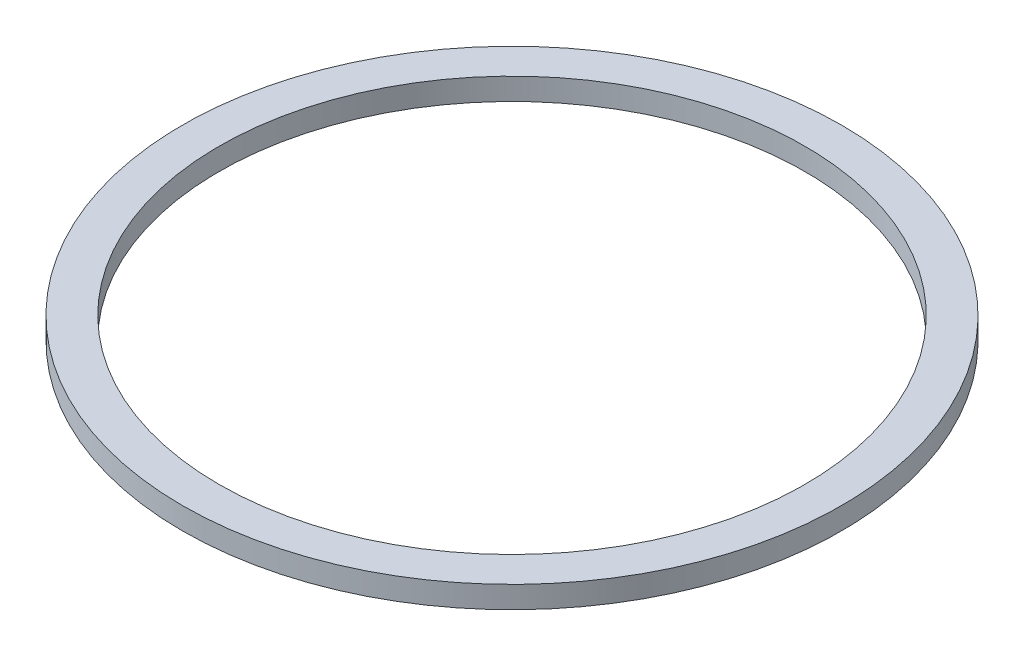
from build123d import *

# Parameters (mm, degrees)
SKETCH2_R           = 37.53
SKETCH2_R_2         = 33.36
BOSS_EXTRUDE1_DEPTH = 2.5


with BuildPart() as part:
    # Sketch2 → Boss-Extrude1 (new body)
    with BuildSketch(Plane(origin=(0, 0, 0), x_dir=(1, 0, 0), z_dir=(0, 1, 0))):
        with Locations(Location((0, 0, 0), (0, 0, 270))):
            Circle(SKETCH2_R)
        with Locations(Location((0, 0, 0), (0, 0, 270))):
            Circle(SKETCH2_R_2, mode=Mode.SUBTRACT)
    extrude(amount=BOSS_EXTRUDE1_DEPTH)


solid = part.part
